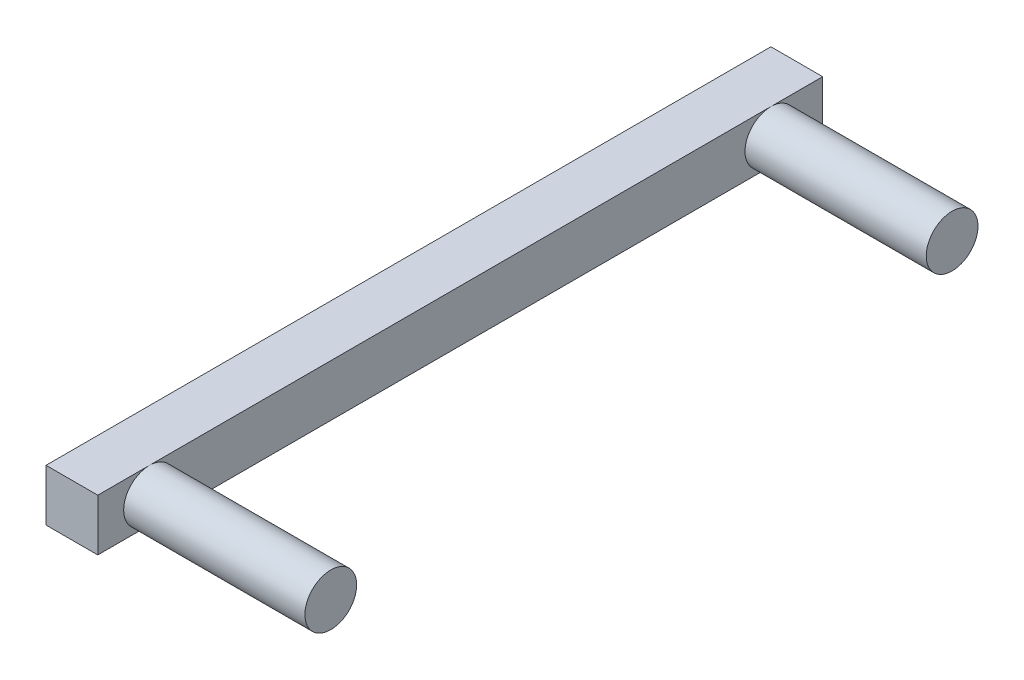
from build123d import *

# Parameters (mm, degrees)
SKETCH_1_W      = 140
SKETCH_1_H      = 10
EXTRUDE_1_DEPTH = 10
SKETCH_2_R      = 5
EXTRUDE_2_DEPTH = 35


with BuildPart() as part:
    # Эскиз1 → Бобышка-Вытянуть1 (new body)
    with BuildSketch(Plane(origin=(0, 0, 0), x_dir=(0, 0, -1), z_dir=(1, 0, 0))):
        with Locations((70, 5)):
            Rectangle(SKETCH_1_W, SKETCH_1_H)
    extrude(amount=EXTRUDE_1_DEPTH)

    # Эскиз2 → Бобышка-Вытянуть2 (add)
    with BuildSketch(Plane(origin=(10, 0, 0), x_dir=(0, 0, -1), z_dir=(1, 0, 0))):
        with Locations(Location((10, 5, 0), (0, 0, 270))):
            Circle(SKETCH_2_R)
        with Locations(Location((130, 5, 0), (0, 0, 270))):
            Circle(SKETCH_2_R)
    extrude(amount=EXTRUDE_2_DEPTH)


solid = part.part
